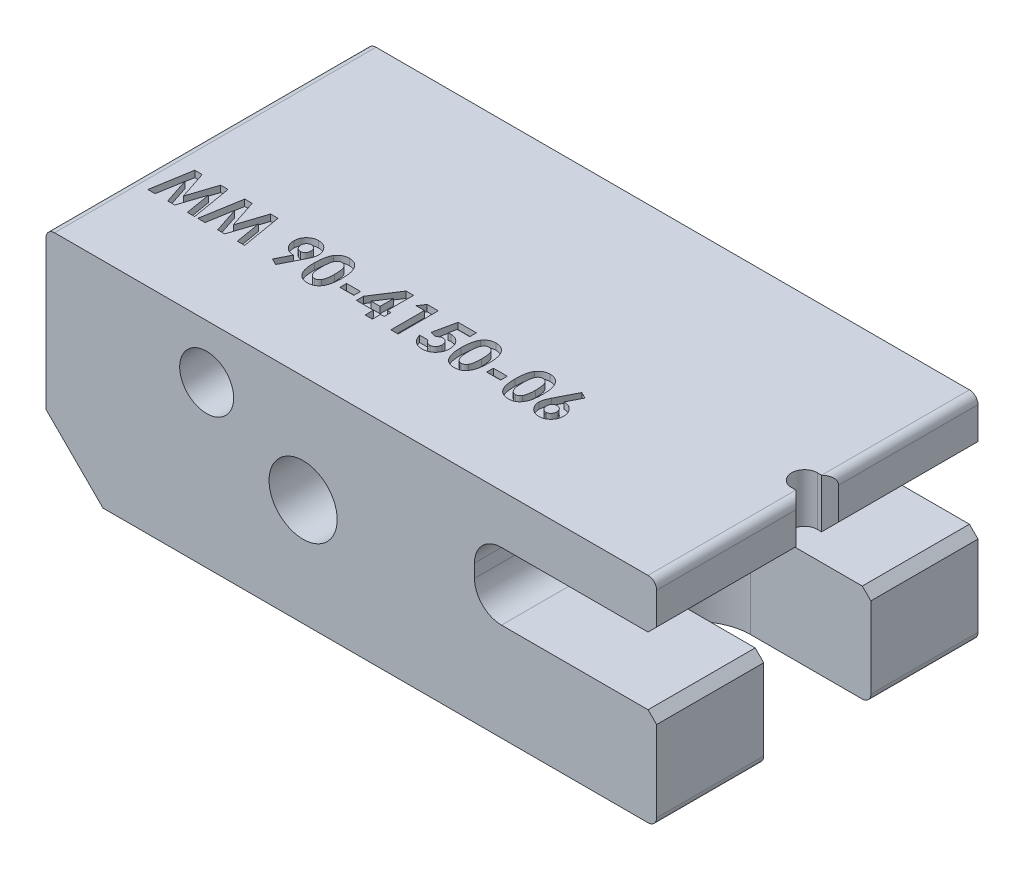
from build123d import *

# Parameters (mm, degrees)
CROQUIS1_W                          = 36.195
CROQUIS1_H                          = 19.05
SALIENTE_EXTRUIR1_DEPTH             = 12.7
TALADRO_ROSCADO_10_321_D            = 4.0386
TALADROS_DE_ESPIGA_DE_1_8_0_126_1_D = 3.2004
CORTAR_EXTRUIR1_DEPTH               = 43.828384571
CORTAR_EXTRUIR2_DEPTH               = 43.828384571
REDONDEO1_R                         = 0.508
CHAFL_N1_SIZE                       = 0.508
CORTAR_EXTRUIR3_DEPTH               = 43.828384571
CORTAR_EXTRUIR4_REACH               = 44.828
CORTAR_EXTRUIR5_DEPTH               = 43.828384646
CROQUIS12_W                         = 0.824278847
CROQUIS12_H                         = 0.396875
CROQUIS12_W_2                       = 0.824278846
CORTAR_EXTRUIR6_DEPTH               = 0.381


with BuildPart() as part:
    # Croquis1 → Saliente-Extruir1 (new body)
    with BuildSketch(Plane(origin=(0, 0, 0), x_dir=(1, 0, 0), z_dir=(0, 1, 0))):
        with Locations((18.0975, -9.525)):
            Rectangle(CROQUIS1_W, CROQUIS1_H)
    extrude(amount=SALIENTE_EXTRUIR1_DEPTH)

    # Taladro roscado #10-321 (through all)
    with Locations(Plane.XY.offset(19.05)):
        with Locations((15.24, 6.35)):
            Hole(TALADRO_ROSCADO_10_321_D / 2)

    # Taladros de espiga de 1/8 (0.126)1 (through all)
    with Locations(Plane.XY.offset(19.05)):
        with Locations((9.525, 9.525)):
            Hole(TALADROS_DE_ESPIGA_DE_1_8_0_126_1_D / 2)

    # Croquis6 → Cortar-Extruir1 (cut, through all)
    with BuildSketch(Plane.XY.offset(19.05)):
        with BuildLine():
            Line((36.195, 5.8039), (27.0002, 5.8039))
            ThreePointArc((27.0002, 5.8039), (25.868687729, 6.272587729), (25.4, 7.4041))
            Line((25.4, 7.4041), (25.4, 8.1915))
            ThreePointArc((25.4, 8.1915), (25.868687729, 9.323012271), (27.0002, 9.7917))
            Line((27.0002, 9.7917), (36.195, 9.7917))
            ThreePointArc((36.195, 9.7917), (38.1889, 7.7978), (36.195, 5.8039))
        make_face()
    extrude(amount=-CORTAR_EXTRUIR1_DEPTH, mode=Mode.SUBTRACT)

    # Croquis7 → Cortar-Extruir2 (cut, through all)
    with BuildSketch(Plane.XY.offset(19.05)):
        Polygon((0, 3.3782), (3.3782, 0), (0, 0), align=None)
    extrude(amount=-CORTAR_EXTRUIR2_DEPTH, mode=Mode.SUBTRACT)

    # Redondeo1
    redondeo1_edges = [part.edges().sort_by_distance(p)[0] for p in [
        (36.195, 12.7, 9.525),
        (0, 12.7, 9.525),
        (36.195, 0, 9.525),
    ]]
    fillet(redondeo1_edges, radius=REDONDEO1_R)

    # Chaflán1
    chafl_n1_edges = [part.edges().sort_by_distance(p)[0] for p in [
        (36.195, 9.7917, 9.525),
        (36.195, 5.8039, 9.525),
    ]]
    chamfer(chafl_n1_edges, length=CHAFL_N1_SIZE)

    # Croquis8 → Cortar-Extruir3 (cut, through all)
    with BuildSketch(Plane(origin=(0, 12.7, 0), x_dir=(1, 0, 0), z_dir=(0, 1, 0))):
        with BuildLine():
            Line((36.195, -10.287), (35.433, -10.287))
            ThreePointArc((35.433, -10.287), (34.671, -9.525), (35.433, -8.763))
            Line((35.433, -8.763), (36.195, -8.763))
            ThreePointArc((36.195, -8.763), (36.957, -9.525), (36.195, -10.287))
        make_face()
    extrude(amount=-CORTAR_EXTRUIR3_DEPTH, mode=Mode.SUBTRACT)

    # Croquis9 → Cortar-Extruir4 (cut, up to next)
    with BuildSketch(Plane(origin=(0, 0, 0), x_dir=(1, 0, 0), z_dir=(0, 1, 0)), mode=Mode.PRIVATE) as cortar_extruir4_sk1:
        with BuildLine():
            Line((36.195, -12.7), (29.0576, -12.7))
            ThreePointArc((29.0576, -12.7), (25.8826, -9.525), (29.0576, -6.35))
            Line((29.0576, -6.35), (36.195, -6.35))
            ThreePointArc((36.195, -6.35), (39.37, -9.525), (36.195, -12.7))
        make_face()
    cortar_extruir4_tool1 = extrude(cortar_extruir4_sk1.sketch, amount=CORTAR_EXTRUIR4_REACH, mode=Mode.PRIVATE) & part.part
    add(cortar_extruir4_tool1.solids().sort_by_distance((32.6263, 0, 9.525))[0], mode=Mode.SUBTRACT)

    # Croquis11 → Cortar-Extruir5 (cut, through all)
    with BuildSketch(Plane(origin=(0, 12.7, 0), x_dir=(1, 0, 0), z_dir=(0, 1, 0))):
        Polygon((35.687, -8.763), (36.195, -8.255), (36.195, -8.763), align=None)
        Polygon((35.687, -10.287), (36.195, -10.795), (36.195, -10.287), align=None)
    extrude(amount=-CORTAR_EXTRUIR5_DEPTH, mode=Mode.SUBTRACT)

    # Croquis12 → Cortar-Extruir6 (cut)
    # profile 1 of 12: a face of its own
    with BuildSketch(Plane(origin=(0, 12.7, 0), x_dir=(1, 0, 0), z_dir=(0, 1, 0))):
        Polygon((1.45230255, -11.68486249), (1.895924846, -11.68486249), (2.439242904, -13.345822526), (2.986377069, -11.68486249), (3.425706246, -11.68486249), (3.828305404, -14.06611249), (3.395654413, -14.06611249), (3.141406366, -12.562089804), (2.646266642, -14.06611249), (2.229357087, -14.06611249), (1.737079443, -12.562089804), (1.483308409, -14.06611249), (1.050180404, -14.06611249), align=None)
    # profile 2 of 12: a face of its own
    with BuildSketch(Plane(origin=(0, 12.7, 0), x_dir=(1, 0, 0), z_dir=(0, 1, 0))):
        Polygon((4.413600627, -11.68486249), (4.857222922, -11.68486249), (5.400540981, -13.345822526), (5.947675146, -11.68486249), (6.387004323, -11.68486249), (6.789603481, -14.06611249), (6.35695249, -14.06611249), (6.102704443, -12.562089804), (5.607564719, -14.06611249), (5.190655164, -14.06611249), (4.69837752, -12.562089804), (4.444606486, -14.06611249), (4.011478481, -14.06611249), align=None)
    # profile 3 of 12: a face of its own
    with BuildSketch(Plane(origin=(0, 12.7, 0), x_dir=(1, 0, 0), z_dir=(0, 1, 0))):
        with BuildLine():
            Line((8.691932207, -14.127170182), (8.31318371, -13.936364894))
            Line((8.31318371, -13.936364894), (8.728185212, -13.119718259))
            add(Edge.make_bspline(
                [(8.728185212, -13.119718259), (8.703665971, -13.119093296), (8.655528767, -13.117866343), (8.584650491, -13.107670372), (8.516871302, -13.090265199), (8.451392306, -13.067094529), (8.389119058, -13.036031844), (8.329296445, -12.99896016), (8.272752613, -12.954419065), (8.219222453, -12.904353033), (8.170347706, -12.849013861), (8.12792546, -12.789497518), (8.090949592, -12.727313759), (8.06219513, -12.661058742), (8.039099399, -12.591967294), (8.022224493, -12.519681792), (8.012754743, -12.443885092), (8.01143114, -12.392298687), (8.010757327, -12.36603737)],
                knots=[0, 0, 0, 0, 1.014336294, 1.991387562, 2.955278539, 3.906441712, 4.859855302, 5.829322156, 6.813833455, 7.833278715, 8.858926674, 9.863225732, 10.85404919, 11.846815163, 12.845559416, 13.865450493, 14.913355531, 16, 16, 16, 16], degree=3))
            add(Edge.make_bspline(
                [(8.010757327, -12.36603737), (8.011382325, -12.340564151), (8.01261387, -12.2903697), (8.022841971, -12.216700581), (8.039674778, -12.145967464), (8.062768787, -12.078182366), (8.093512789, -12.013802372), (8.12949786, -11.951819443), (8.173487978, -11.893515937), (8.223181845, -11.838639459), (8.277569146, -11.788437171), (8.335269506, -11.744297092), (8.396020571, -11.707400227), (8.45904163, -11.676413667), (8.525471834, -11.653262437), (8.594351191, -11.635795006), (8.666192809, -11.625713801), (8.7149574, -11.624446224), (8.739633529, -11.623804798)],
                knots=[0, 0, 0, 0, 1.055538678, 2.079917126, 3.075849687, 4.065898488, 5.041806164, 6.028602842, 7.031727914, 8.062953097, 9.093756959, 10.095582084, 11.068815425, 12.035667573, 13.000833448, 13.979119574, 14.977382875, 16, 16, 16, 16], degree=3))
            add(Edge.make_bspline(
                [(8.739633529, -11.623804798), (8.765435407, -11.624335901), (8.81617131, -11.625380245), (8.890441857, -11.636904166), (8.96150091, -11.654583968), (9.029637195, -11.678596746), (9.094004826, -11.711187057), (9.1551424, -11.750246771), (9.212846553, -11.79664011), (9.266497586, -11.849029875), (9.315292601, -11.906013546), (9.35854331, -11.965661703), (9.394875742, -12.027857717), (9.424634227, -12.092046509), (9.447815936, -12.158328639), (9.463750407, -12.226798126), (9.474329128, -12.297337883), (9.475532776, -12.345169052), (9.476141943, -12.369376462)],
                knots=[0, 0, 0, 0, 1.062826075, 2.08990367, 3.089830715, 4.078784409, 5.060762809, 6.057138927, 7.064407536, 8.107320944, 9.143871033, 10.153461498, 11.140480137, 12.108246174, 13.065926856, 14.029354859, 15.002654194, 16, 16, 16, 16], degree=3))
            add(Edge.make_bspline(
                [(9.476141943, -12.369376462), (9.475809515, -12.387838879), (9.475139929, -12.425026338), (9.468556058, -12.480792964), (9.458566999, -12.536714152), (9.446972581, -12.583730002), (9.434817447, -12.623361508), (9.422989117, -12.65698149), (9.407813022, -12.694305984), (9.390867394, -12.735585165), (9.371242364, -12.78063802), (9.34853104, -12.829249179), (9.324106035, -12.882139594), (9.306102395, -12.918305339), (9.296784972, -12.937022196)],
                knots=[0, 0, 0, 0, 1.105131805, 2.225983929, 3.357782449, 4.505488967, 5.122909461, 5.839607681, 6.638776516, 7.535249922, 8.51168636, 9.581005249, 10.748097757, 12, 12, 12, 12], degree=3))
            Line((9.296784972, -12.937022196), (8.691932207, -14.127170182))
        make_face()
        with BuildLine():
            add(Edge.make_bspline(
                [(8.749173794, -12.722843259), (8.769653205, -12.721637577), (8.809665339, -12.719281947), (8.867140107, -12.701067712), (8.918577103, -12.669898209), (8.96416758, -12.62848911), (9.001842154, -12.577968114), (9.029234035, -12.520454452), (9.046106591, -12.457139167), (9.047844079, -12.413050637), (9.048738097, -12.390365044)],
                knots=[0, 0, 0, 0, 0.984774978, 1.924027336, 2.867853169, 3.859505234, 4.871392407, 5.881338128, 6.909850265, 8, 8, 8, 8], degree=3))
            add(Edge.make_bspline(
                [(9.048738097, -12.390365044), (9.047661349, -12.367207539), (9.045566819, -12.322160662), (9.028532631, -12.257325568), (8.99942463, -12.198718488), (8.959824861, -12.147772796), (8.913592646, -12.10513776), (8.86189336, -12.073994014), (8.80598237, -12.05473572), (8.767290008, -12.052392454), (8.747742754, -12.051208644)],
                knots=[0, 0, 0, 0, 1.104110315, 2.147758178, 3.172670271, 4.206310416, 5.210906102, 6.157051016, 7.068948237, 8, 8, 8, 8], degree=3))
            add(Edge.make_bspline(
                [(8.747742754, -12.051208644), (8.727082404, -12.052362706), (8.686515976, -12.054628698), (8.628327346, -12.073840745), (8.574686565, -12.104386427), (8.527843289, -12.147166121), (8.48730223, -12.197440875), (8.459031843, -12.25624578), (8.441147015, -12.32062843), (8.43917435, -12.36575609), (8.438161174, -12.388934004)],
                knots=[0, 0, 0, 0, 0.970967322, 1.90648639, 2.855811969, 3.858352357, 4.877096915, 5.878517833, 6.91039038, 8, 8, 8, 8], degree=3))
            add(Edge.make_bspline(
                [(8.438161174, -12.388934004), (8.439219499, -12.411781535), (8.441277831, -12.456217596), (8.458528748, -12.519891967), (8.486628764, -12.577709996), (8.52504349, -12.628629421), (8.572360973, -12.670242548), (8.626086331, -12.701080032), (8.686015726, -12.719331335), (8.727742132, -12.721651545), (8.749173794, -12.722843259)],
                knots=[0, 0, 0, 0, 1.075706617, 2.092137047, 3.084482865, 4.090466434, 5.0784141, 6.035155512, 6.990809768, 8, 8, 8, 8], degree=3))
        make_face(mode=Mode.SUBTRACT)
    # profile 4 of 12: a face of its own
    with BuildSketch(Plane(origin=(0, 12.7, 0), x_dir=(1, 0, 0), z_dir=(0, 1, 0))):
        with BuildLine():
            add(Edge.make_bspline(
                [(10.552760783, -11.623804798), (10.573448903, -11.624111919), (10.614127275, -11.624715801), (10.674038859, -11.631256333), (10.731750279, -11.641137254), (10.787487309, -11.654917693), (10.840848749, -11.673155614), (10.892222973, -11.694986092), (10.940998481, -11.721554181), (10.987797315, -11.751564202), (11.032601449, -11.785539801), (11.074334046, -11.824273737), (11.113757233, -11.866874742), (11.150017642, -11.913986866), (11.183918272, -11.965181575), (11.21534773, -12.020466987), (11.244065417, -12.080113686), (11.27039319, -12.144229309), (11.293935567, -12.213774923), (11.313765282, -12.289548245), (11.33077258, -12.371566581), (11.34512794, -12.460034085), (11.355978273, -12.555068352), (11.363291615, -12.656606246), (11.368310376, -12.764452018), (11.368719973, -12.838433331), (11.368930404, -12.876441516)],
                knots=[0, 0, 0, 0, 0.879237366, 1.728815576, 2.559023295, 3.367336655, 4.166867292, 4.954216142, 5.737608147, 6.525189134, 7.316157332, 8.124696809, 8.942788509, 9.781158001, 10.649253743, 11.551476218, 12.482711956, 13.461909668, 14.496590415, 15.601789533, 16.789733467, 18.056700938, 19.410929216, 20.8549011, 22.384193279, 24, 24, 24, 24], degree=3))
            add(Edge.make_bspline(
                [(11.368930404, -12.876441516), (11.368702985, -12.914925227), (11.368261112, -12.989698387), (11.363500246, -13.098530571), (11.35530181, -13.200805691), (11.344735074, -13.296513167), (11.330261537, -13.385602458), (11.313311012, -13.468304244), (11.293168291, -13.544588547), (11.268850435, -13.614283485), (11.242682026, -13.678511709), (11.213885784, -13.738042111), (11.182963623, -13.793035932), (11.150624806, -13.844322828), (11.115096398, -13.890390887), (11.078107669, -13.932806665), (11.038048062, -13.96995449), (10.996604241, -14.003748794), (10.952257953, -14.032953855), (10.905466528, -14.058496119), (10.855395757, -14.079213929), (10.802958344, -14.097233174), (10.747260485, -14.110169048), (10.689187208, -14.120433238), (10.628082881, -14.126105859), (10.586480593, -14.126809585), (10.565163127, -14.127170182)],
                knots=[0, 0, 0, 0, 1.643780988, 3.193836972, 4.651895693, 6.025988579, 7.305620092, 8.505800249, 9.631074763, 10.672816429, 11.65661981, 12.592235626, 13.49536222, 14.350718032, 15.179365177, 15.97804903, 16.751647189, 17.51006938, 18.259804725, 19.016521909, 19.783502495, 20.571750527, 21.382245291, 22.22305063, 23.089471752, 24, 24, 24, 24], degree=3))
            add(Edge.make_bspline(
                [(10.565163127, -14.127170182), (10.543846236, -14.12680263), (10.50208676, -14.1260826), (10.4408172, -14.120475417), (10.382436165, -14.110127467), (10.326297646, -14.097133862), (10.272792357, -14.079253799), (10.221663744, -14.057916127), (10.17330494, -14.032533233), (10.127582048, -14.003260127), (10.084651178, -13.969691933), (10.043845186, -13.932187698), (10.005254336, -13.890842488), (9.969465691, -13.845193202), (9.935893137, -13.795849161), (9.904886782, -13.742246882), (9.87646526, -13.684464408), (9.84973954, -13.622421196), (9.826518273, -13.554781527), (9.805852424, -13.480941387), (9.788923504, -13.400285258), (9.775308133, -13.312839052), (9.764437629, -13.218788027), (9.756351224, -13.118086787), (9.751563913, -13.010688428), (9.751126675, -12.936868186), (9.750901558, -12.898861138)],
                knots=[0, 0, 0, 0, 0.917216111, 1.796812873, 2.643793957, 3.46689424, 4.273913431, 5.068098542, 5.848489301, 6.620921603, 7.401012384, 8.190319798, 9.003608147, 9.831726257, 10.68377682, 11.569763213, 12.493818149, 13.453288342, 14.474581811, 15.568529029, 16.750744269, 18.018426408, 19.375425659, 20.823733699, 22.36466933, 24, 24, 24, 24], degree=3))
            add(Edge.make_bspline(
                [(9.750901558, -12.898861138), (9.751309336, -12.846053337), (9.752096147, -12.744160004), (9.762067203, -12.596953765), (9.776702185, -12.460887096), (9.798197505, -12.336187604), (9.824776172, -12.222393438), (9.858811539, -12.120254216), (9.897558328, -12.028356611), (9.93057557, -11.973915916), (9.946476979, -11.947696775)],
                knots=[0, 0, 0, 0, 1.288568992, 2.486310467, 3.599230591, 4.627010532, 5.572937695, 6.447898582, 7.252493626, 8, 8, 8, 8], degree=3))
            add(Edge.make_bspline(
                [(9.946476979, -11.947696775), (9.96496638, -11.921939099), (10.001116801, -11.871577767), (10.064326824, -11.805462751), (10.132237763, -11.748917952), (10.206244471, -11.70322303), (10.285176502, -11.66718801), (10.369711525, -11.641736881), (10.459537369, -11.626907868), (10.521222274, -11.624854601), (10.552760783, -11.623804798)],
                knots=[0, 0, 0, 0, 1.058512271, 2.069600068, 3.047294572, 4.004278952, 4.967380941, 5.939006123, 6.946246673, 8, 8, 8, 8], degree=3))
        make_face()
        with BuildLine():
            add(Edge.make_bspline(
                [(10.563255074, -12.051208644), (10.544552842, -12.052095092), (10.507886539, -12.053833002), (10.454681987, -12.068585405), (10.404513416, -12.091371286), (10.366351524, -12.118790532), (10.337787728, -12.145075167), (10.317829998, -12.168861907), (10.298583914, -12.195406194), (10.281584803, -12.225905837), (10.265533204, -12.259264945), (10.249845955, -12.295634951), (10.236986529, -12.33590918), (10.224352484, -12.379401756), (10.213283882, -12.427315134), (10.20401082, -12.480040952), (10.195726155, -12.537922093), (10.189947502, -12.600996467), (10.184560063, -12.669198084), (10.180698091, -12.74267887), (10.179083498, -12.821419002), (10.178570268, -12.875646162), (10.178305404, -12.90363127)],
                knots=[0, 0, 0, 0, 1.076674018, 2.110852608, 3.161083442, 4.239746716, 4.804137807, 5.395870207, 6.026861976, 6.692161227, 7.405688833, 8.16177676, 8.973626916, 9.841385931, 10.773283133, 11.807421078, 12.927755683, 14.143907515, 15.458935494, 16.872852025, 18.386167141, 20, 20, 20, 20], degree=3))
            add(Edge.make_bspline(
                [(10.178305404, -12.90363127), (10.178741338, -12.93988733), (10.179577272, -13.009411013), (10.183955506, -13.10938849), (10.192731312, -13.200376045), (10.203646643, -13.282990334), (10.218977671, -13.35669558), (10.236617011, -13.422189105), (10.258400027, -13.478636024), (10.2835745, -13.526852687), (10.311456363, -13.567870502), (10.341723352, -13.60273583), (10.373344984, -13.632927559), (10.407308274, -13.657451928), (10.443532194, -13.676246274), (10.481714343, -13.689764815), (10.521878983, -13.698040077), (10.549383315, -13.69918759), (10.563255074, -13.699766336)],
                knots=[0, 0, 0, 0, 1.771748488, 3.397459088, 4.888034009, 6.237357457, 7.467047327, 8.564189669, 9.548206622, 10.417051504, 11.216568818, 11.965764335, 12.669334354, 13.348544111, 14.005342236, 14.656555988, 15.322436492, 16, 16, 16, 16], degree=3))
            add(Edge.make_bspline(
                [(10.563255074, -13.699766336), (10.576650798, -13.699370315), (10.60287796, -13.698594955), (10.641123037, -13.690635991), (10.677290298, -13.677696443), (10.711270545, -13.659392544), (10.74318532, -13.636116336), (10.772878643, -13.607765533), (10.800126572, -13.574057545), (10.81600134, -13.549041232), (10.824181306, -13.536150801)],
                knots=[0, 0, 0, 0, 0.992283464, 1.942767638, 2.88273346, 3.832339453, 4.79467288, 5.803907806, 6.868395428, 8, 8, 8, 8], degree=3))
            add(Edge.make_bspline(
                [(10.824181306, -13.536150801), (10.833811838, -13.51853644), (10.854006283, -13.481600552), (10.87737533, -13.41927262), (10.897046092, -13.348977013), (10.913976428, -13.270494965), (10.925555746, -13.183516934), (10.93552784, -13.088594455), (10.940337628, -12.985249536), (10.941119967, -12.913651804), (10.941526558, -12.876441516)],
                knots=[0, 0, 0, 0, 0.710965849, 1.490837728, 2.352621235, 3.297892224, 4.334225155, 5.461620853, 6.680770821, 8, 8, 8, 8], degree=3))
            add(Edge.make_bspline(
                [(10.941526558, -12.876441516), (10.941369501, -12.838908226), (10.941067192, -12.766663048), (10.935520698, -12.662946597), (10.927796781, -12.568218833), (10.916498921, -12.482691243), (10.901962171, -12.406156204), (10.884045571, -12.33861872), (10.862923233, -12.279945687), (10.837874656, -12.230195611), (10.810131802, -12.18791487), (10.780681915, -12.151641274), (10.74940047, -12.120671793), (10.716339779, -12.094889884), (10.68073464, -12.075190571), (10.64326516, -12.061281227), (10.603854521, -12.05286654), (10.576970886, -12.051768735), (10.563255074, -12.051208644)],
                knots=[0, 0, 0, 0, 1.793836731, 3.452829483, 4.963243077, 6.335886805, 7.574563692, 8.684454726, 9.672768357, 10.54971625, 11.340229787, 12.085688095, 12.778991901, 13.440269426, 14.083255152, 14.715733572, 15.344777694, 16, 16, 16, 16], degree=3))
        make_face(mode=Mode.SUBTRACT)
    # profile 5 of 12: a face of its own
    with BuildSketch(Plane(origin=(0, 12.7, 0), x_dir=(1, 0, 0), z_dir=(0, 1, 0))):
        with Locations((12.177944827, -13.196040375)):
            Rectangle(CROQUIS12_W, CROQUIS12_H)
    # profile 6 of 12: a face of its own
    with BuildSketch(Plane(origin=(0, 12.7, 0), x_dir=(1, 0, 0), z_dir=(0, 1, 0))):
        Polygon((13.915226979, -11.623804798), (14.360757327, -11.623804798), (14.360757327, -13.180775952), (14.574459251, -13.180775952), (14.574459251, -13.577650952), (14.360757327, -13.577650952), (14.360757327, -14.06611249), (13.933353481, -14.06611249), (13.933353481, -13.577650952), (12.925901558, -13.577650952), (12.925901558, -13.14499996), align=None)
        Polygon((13.933353481, -13.180775952), (13.933353481, -12.370330489), (13.406253872, -13.180775952), align=None, mode=Mode.SUBTRACT)
    # profile 7 of 12: a face of its own
    with BuildSketch(Plane(origin=(0, 12.7, 0), x_dir=(1, 0, 0), z_dir=(0, 1, 0))):
        Polygon((15.226536324, -11.68486249), (15.887199635, -11.68486249), (15.887199635, -14.06611249), (15.459795789, -14.06611249), (15.459795789, -12.08173749), (14.971334251, -12.08173749), align=None)
    # profile 8 of 12: a face of its own
    with BuildSketch(Plane(origin=(0, 12.7, 0), x_dir=(1, 0, 0), z_dir=(0, 1, 0))):
        with BuildLine():
            Line((17.062083199, -11.68486249), (18.146334251, -11.68486249))
            Line((18.146334251, -11.68486249), (18.146334251, -12.08173749))
            Line((18.146334251, -12.08173749), (17.400762586, -12.08173749))
            Line((17.400762586, -12.08173749), (17.307745008, -12.532037971))
            add(Edge.make_bspline(
                [(17.307745008, -12.532037971), (17.320419984, -12.52850783), (17.345417642, -12.521545666), (17.383076645, -12.514563498), (17.419573467, -12.510037878), (17.443522458, -12.50943422), (17.455142093, -12.509141336)],
                knots=[0, 0, 0, 0, 1.05461699, 2.079921384, 3.068411212, 4, 4, 4, 4], degree=3))
            add(Edge.make_bspline(
                [(17.455142093, -12.509141336), (17.480462494, -12.509721538), (17.530374583, -12.510865245), (17.603389635, -12.521722751), (17.673305861, -12.538822994), (17.739909309, -12.563211469), (17.803134917, -12.594953699), (17.863059326, -12.633352899), (17.919756084, -12.678476512), (17.972218017, -12.730352789), (18.020422233, -12.787314117), (18.062333049, -12.848923819), (18.098127502, -12.914303403), (18.126597172, -12.983859265), (18.149067862, -13.057154549), (18.165305685, -13.134236224), (18.174907921, -13.215195644), (18.176202724, -13.270428468), (18.176863097, -13.298598217)],
                knots=[0, 0, 0, 0, 1.01440847, 1.999622559, 2.951875003, 3.895578053, 4.836219714, 5.782137149, 6.743708247, 7.735272588, 8.734977101, 9.730283169, 10.717124674, 11.717316708, 12.737475749, 13.78628267, 14.87096371, 16, 16, 16, 16], degree=3))
            add(Edge.make_bspline(
                [(18.176863097, -13.298598217), (18.17605611, -13.327087758), (18.17446369, -13.383305951), (18.164074608, -13.46596658), (18.145737692, -13.545136802), (18.120550102, -13.621028554), (18.087367066, -13.693084048), (18.047459923, -13.762049727), (18.000153951, -13.82741368), (17.945913384, -13.888505848), (17.886946774, -13.944345262), (17.824161252, -13.993467301), (17.757997908, -14.034803099), (17.688455145, -14.068209413), (17.615931951, -14.094639893), (17.540406315, -14.113880021), (17.461511192, -14.124913166), (17.407951654, -14.126409576), (17.380728031, -14.127170182)],
                knots=[0, 0, 0, 0, 1.06808661, 2.107647099, 3.116961351, 4.110378221, 5.100014249, 6.085620622, 7.093190682, 8.119403071, 9.144090782, 10.133780668, 11.103064255, 12.062861538, 13.020824475, 13.992378307, 14.979551724, 16, 16, 16, 16], degree=3))
            add(Edge.make_bspline(
                [(17.380728031, -14.127170182), (17.356382754, -14.126547959), (17.308368774, -14.125320805), (17.237646289, -14.117778068), (17.169461961, -14.104442438), (17.104177772, -14.085142329), (17.041106825, -14.061388301), (16.980978237, -14.0316794), (16.923461592, -13.996581323), (16.868720215, -13.956734612), (16.817643576, -13.911848836), (16.771026231, -13.862713622), (16.728585955, -13.809948293), (16.691230902, -13.752901887), (16.659078169, -13.691658685), (16.630564469, -13.626940455), (16.60722572, -13.558071329), (16.595381978, -13.510327425), (16.589363097, -13.486064413)],
                knots=[0, 0, 0, 0, 1.054957082, 2.080596141, 3.077793124, 4.061112343, 5.027190972, 5.994718051, 6.962465889, 7.943658696, 8.924948258, 9.904494768, 10.875059, 11.855380583, 12.854004648, 13.869083016, 14.917087635, 16, 16, 16, 16], degree=3))
            Line((16.589363097, -13.486064413), (17.077824635, -13.486064413))
            add(Edge.make_bspline(
                [(17.077824635, -13.486064413), (17.086753724, -13.502877692), (17.104106389, -13.535552382), (17.137114994, -13.578932941), (17.174066031, -13.615926019), (17.214626183, -13.646893045), (17.259058254, -13.670093014), (17.305551721, -13.687686797), (17.354690661, -13.697853593), (17.388156449, -13.699124543), (17.405055705, -13.699766336)],
                knots=[0, 0, 0, 0, 1.104910296, 2.147267069, 3.153527244, 4.136738762, 5.099945312, 6.05603338, 7.018353, 8, 8, 8, 8], degree=3))
            add(Edge.make_bspline(
                [(17.405055705, -13.699766336), (17.41683426, -13.699323172), (17.440008765, -13.69845124), (17.474152734, -13.6938385), (17.506744653, -13.685102075), (17.538026834, -13.673004156), (17.568083309, -13.657916686), (17.596483209, -13.638869738), (17.623720641, -13.616945994), (17.64938094, -13.591788424), (17.672621775, -13.563743585), (17.693001445, -13.533607494), (17.71122368, -13.502049781), (17.724721168, -13.467820365), (17.73577447, -13.43194135), (17.743914568, -13.39414209), (17.748779195, -13.354378436), (17.749229529, -13.327232905), (17.749459251, -13.313385627)],
                knots=[0, 0, 0, 0, 0.978869489, 1.925942215, 2.855067702, 3.774946051, 4.70828698, 5.642468714, 6.60995405, 7.609372294, 8.622401667, 9.629904756, 10.629323, 11.642352373, 12.678539694, 13.745912462, 14.850161547, 16, 16, 16, 16], degree=3))
            add(Edge.make_bspline(
                [(17.749459251, -13.313385627), (17.749192633, -13.299859776), (17.748673654, -13.273531379), (17.74438056, -13.234871861), (17.736700299, -13.198190975), (17.726235876, -13.163207773), (17.712840166, -13.13013469), (17.696469713, -13.098774858), (17.677054581, -13.06928679), (17.654490533, -13.042270834), (17.630428465, -13.017491031), (17.604578072, -12.995818813), (17.577172252, -12.977832377), (17.549062608, -12.962129695), (17.519127104, -12.950701625), (17.488038869, -12.942831535), (17.455830596, -12.937056779), (17.433862032, -12.936717491), (17.422705194, -12.936545182)],
                knots=[0, 0, 0, 0, 1.166249705, 2.270133367, 3.348514167, 4.393962215, 5.415026464, 6.420877785, 7.440098956, 8.453121383, 9.451844239, 10.415694839, 11.355045125, 12.27538808, 13.187007209, 14.108269027, 15.039275622, 16, 16, 16, 16], degree=3))
            add(Edge.make_bspline(
                [(17.422705194, -12.936545182), (17.410586276, -12.937005028), (17.386297363, -12.937926657), (17.350210118, -12.945425709), (17.314557985, -12.957561987), (17.279142701, -12.974305906), (17.244315824, -12.996218413), (17.209158257, -13.021919272), (17.174846798, -13.053275893), (17.153030617, -13.076630376), (17.141744407, -13.0887124)],
                knots=[0, 0, 0, 0, 0.88288272, 1.769486374, 2.674910571, 3.623812639, 4.617874466, 5.670434592, 6.794841017, 8, 8, 8, 8], degree=3))
            Line((17.141744407, -13.0887124), (16.782076438, -13.006189113))
            Line((16.782076438, -13.006189113), (17.062083199, -11.68486249))
        make_face()
    # profile 9 of 12: a face of its own
    with BuildSketch(Plane(origin=(0, 12.7, 0), x_dir=(1, 0, 0), z_dir=(0, 1, 0))):
        with BuildLine():
            add(Edge.make_bspline(
                [(19.253481937, -11.623804798), (19.274170057, -11.624111919), (19.314848429, -11.624715801), (19.374760013, -11.631256333), (19.432471433, -11.641137254), (19.488208463, -11.654917693), (19.541569903, -11.673155614), (19.592944127, -11.694986092), (19.641719635, -11.721554181), (19.688518469, -11.751564202), (19.733322602, -11.785539801), (19.7750552, -11.824273737), (19.814478386, -11.866874742), (19.850738796, -11.913986866), (19.884639426, -11.965181575), (19.916068884, -12.020466987), (19.944786571, -12.080113686), (19.971114343, -12.144229309), (19.99465672, -12.213774923), (20.014486435, -12.289548245), (20.031493734, -12.371566581), (20.045849094, -12.460034085), (20.056699426, -12.555068352), (20.064012769, -12.656606246), (20.06903153, -12.764452018), (20.069441127, -12.838433331), (20.069651558, -12.876441516)],
                knots=[0, 0, 0, 0, 0.879237366, 1.728815576, 2.559023295, 3.367336655, 4.166867292, 4.954216142, 5.737608147, 6.525189134, 7.316157332, 8.124696809, 8.942788509, 9.781158001, 10.649253743, 11.551476218, 12.482711956, 13.461909668, 14.496590415, 15.601789533, 16.789733467, 18.056700938, 19.410929216, 20.8549011, 22.384193279, 24, 24, 24, 24], degree=3))
            add(Edge.make_bspline(
                [(20.069651558, -12.876441516), (20.069424138, -12.914925227), (20.068982266, -12.989698387), (20.0642214, -13.098530571), (20.056022964, -13.200805691), (20.045456228, -13.296513167), (20.03098269, -13.385602458), (20.014032166, -13.468304244), (19.993889445, -13.544588547), (19.969571589, -13.614283485), (19.94340318, -13.678511709), (19.914606938, -13.738042111), (19.883684777, -13.793035932), (19.85134596, -13.844322828), (19.815817552, -13.890390887), (19.778828823, -13.932806665), (19.738769215, -13.96995449), (19.697325395, -14.003748794), (19.652979107, -14.032953855), (19.606187682, -14.058496119), (19.556116911, -14.079213929), (19.503679498, -14.097233174), (19.447981638, -14.110169048), (19.389908362, -14.120433238), (19.328804034, -14.126105859), (19.287201747, -14.126809585), (19.265884281, -14.127170182)],
                knots=[0, 0, 0, 0, 1.643780988, 3.193836972, 4.651895693, 6.025988579, 7.305620092, 8.505800249, 9.631074763, 10.672816429, 11.65661981, 12.592235626, 13.49536222, 14.350718032, 15.179365177, 15.97804903, 16.751647189, 17.51006938, 18.259804725, 19.016521909, 19.783502495, 20.571750527, 21.382245291, 22.22305063, 23.089471752, 24, 24, 24, 24], degree=3))
            add(Edge.make_bspline(
                [(19.265884281, -14.127170182), (19.24456739, -14.12680263), (19.202807914, -14.1260826), (19.141538354, -14.120475417), (19.083157319, -14.110127467), (19.027018799, -14.097133862), (18.973513511, -14.079253799), (18.922384897, -14.057916127), (18.874026094, -14.032533233), (18.828303201, -14.003260127), (18.785372332, -13.969691933), (18.74456634, -13.932187698), (18.70597549, -13.890842488), (18.670186845, -13.845193202), (18.636614291, -13.795849161), (18.605607935, -13.742246882), (18.577186414, -13.684464408), (18.550460694, -13.622421196), (18.527239427, -13.554781527), (18.506573578, -13.480941387), (18.489644657, -13.400285258), (18.476029287, -13.312839052), (18.465158783, -13.218788027), (18.457072377, -13.118086787), (18.452285067, -13.010688428), (18.451847829, -12.936868186), (18.451622712, -12.898861138)],
                knots=[0, 0, 0, 0, 0.917216111, 1.796812873, 2.643793957, 3.46689424, 4.273913431, 5.068098542, 5.848489301, 6.620921603, 7.401012384, 8.190319798, 9.003608147, 9.831726257, 10.68377682, 11.569763213, 12.493818149, 13.453288342, 14.474581811, 15.568529029, 16.750744269, 18.018426408, 19.375425659, 20.823733699, 22.36466933, 24, 24, 24, 24], degree=3))
            add(Edge.make_bspline(
                [(18.451622712, -12.898861138), (18.452030489, -12.846053337), (18.452817301, -12.744160004), (18.462788357, -12.596953765), (18.477423338, -12.460887096), (18.498918659, -12.336187604), (18.525497326, -12.222393438), (18.559532693, -12.120254216), (18.598279482, -12.028356611), (18.631296724, -11.973915916), (18.647198133, -11.947696775)],
                knots=[0, 0, 0, 0, 1.288568992, 2.486310467, 3.599230591, 4.627010532, 5.572937695, 6.447898582, 7.252493626, 8, 8, 8, 8], degree=3))
            add(Edge.make_bspline(
                [(18.647198133, -11.947696775), (18.665687533, -11.921939099), (18.701837955, -11.871577767), (18.765047978, -11.805462751), (18.832958917, -11.748917952), (18.906965625, -11.70322303), (18.985897655, -11.66718801), (19.070432679, -11.641736881), (19.160258523, -11.626907868), (19.221943428, -11.624854601), (19.253481937, -11.623804798)],
                knots=[0, 0, 0, 0, 1.058512271, 2.069600068, 3.047294572, 4.004278952, 4.967380941, 5.939006123, 6.946246673, 8, 8, 8, 8], degree=3))
        make_face()
        with BuildLine():
            add(Edge.make_bspline(
                [(19.263976228, -12.051208644), (19.245273996, -12.052095092), (19.208607693, -12.053833002), (19.155403141, -12.068585405), (19.10523457, -12.091371286), (19.067072678, -12.118790532), (19.038508881, -12.145075167), (19.018551152, -12.168861907), (18.999305068, -12.195406194), (18.982305956, -12.225905837), (18.966254358, -12.259264945), (18.950567108, -12.295634951), (18.937707683, -12.33590918), (18.925073638, -12.379401756), (18.914005036, -12.427315134), (18.904731974, -12.480040952), (18.896447309, -12.537922093), (18.890668655, -12.600996467), (18.885281216, -12.669198084), (18.881419245, -12.74267887), (18.879804652, -12.821419002), (18.879291422, -12.875646162), (18.879026558, -12.90363127)],
                knots=[0, 0, 0, 0, 1.076674018, 2.110852608, 3.161083442, 4.239746716, 4.804137807, 5.395870207, 6.026861976, 6.692161227, 7.405688833, 8.16177676, 8.973626916, 9.841385931, 10.773283133, 11.807421078, 12.927755683, 14.143907515, 15.458935494, 16.872852025, 18.386167141, 20, 20, 20, 20], degree=3))
            add(Edge.make_bspline(
                [(18.879026558, -12.90363127), (18.879462492, -12.93988733), (18.880298426, -13.009411013), (18.88467666, -13.10938849), (18.893452466, -13.200376045), (18.904367797, -13.282990334), (18.919698825, -13.35669558), (18.937338165, -13.422189105), (18.959121181, -13.478636024), (18.984295654, -13.526852687), (19.012177517, -13.567870502), (19.042444506, -13.60273583), (19.074066138, -13.632927559), (19.108029428, -13.657451928), (19.144253348, -13.676246274), (19.182435497, -13.689764815), (19.222600137, -13.698040077), (19.250104469, -13.69918759), (19.263976228, -13.699766336)],
                knots=[0, 0, 0, 0, 1.771748488, 3.397459088, 4.888034009, 6.237357457, 7.467047327, 8.564189669, 9.548206622, 10.417051504, 11.216568818, 11.965764335, 12.669334354, 13.348544111, 14.005342236, 14.656555988, 15.322436492, 16, 16, 16, 16], degree=3))
            add(Edge.make_bspline(
                [(19.263976228, -13.699766336), (19.277371952, -13.699370315), (19.303599114, -13.698594955), (19.34184419, -13.690635991), (19.378011452, -13.677696443), (19.411991699, -13.659392544), (19.443906474, -13.636116336), (19.473599797, -13.607765533), (19.500847726, -13.574057545), (19.516722494, -13.549041232), (19.52490246, -13.536150801)],
                knots=[0, 0, 0, 0, 0.992283464, 1.942767638, 2.88273346, 3.832339453, 4.79467288, 5.803907806, 6.868395428, 8, 8, 8, 8], degree=3))
            add(Edge.make_bspline(
                [(19.52490246, -13.536150801), (19.534532992, -13.51853644), (19.554727437, -13.481600552), (19.578096484, -13.41927262), (19.597767245, -13.348977013), (19.614697582, -13.270494965), (19.626276899, -13.183516934), (19.636248993, -13.088594455), (19.641058782, -12.985249536), (19.641841121, -12.913651804), (19.642247712, -12.876441516)],
                knots=[0, 0, 0, 0, 0.710965849, 1.490837728, 2.352621235, 3.297892224, 4.334225155, 5.461620853, 6.680770821, 8, 8, 8, 8], degree=3))
            add(Edge.make_bspline(
                [(19.642247712, -12.876441516), (19.642090655, -12.838908226), (19.641788346, -12.766663048), (19.636241852, -12.662946597), (19.628517935, -12.568218833), (19.617220075, -12.482691243), (19.602683325, -12.406156204), (19.584766725, -12.33861872), (19.563644386, -12.279945687), (19.53859581, -12.230195611), (19.510852956, -12.18791487), (19.481403069, -12.151641274), (19.450121624, -12.120671793), (19.417060932, -12.094889884), (19.381455794, -12.075190571), (19.343986313, -12.061281227), (19.304575675, -12.05286654), (19.27769204, -12.051768735), (19.263976228, -12.051208644)],
                knots=[0, 0, 0, 0, 1.793836731, 3.452829483, 4.963243077, 6.335886805, 7.574563692, 8.684454726, 9.672768357, 10.54971625, 11.340229787, 12.085688095, 12.778991901, 13.440269426, 14.083255152, 14.715733572, 15.344777694, 16, 16, 16, 16], degree=3))
        make_face(mode=Mode.SUBTRACT)
    # profile 10 of 12: a face of its own
    with BuildSketch(Plane(origin=(0, 12.7, 0), x_dir=(1, 0, 0), z_dir=(0, 1, 0))):
        with Locations((20.878665981, -13.196040375)):
            Rectangle(CROQUIS12_W_2, CROQUIS12_H)
    # profile 11 of 12: a face of its own
    with BuildSketch(Plane(origin=(0, 12.7, 0), x_dir=(1, 0, 0), z_dir=(0, 1, 0))):
        with BuildLine():
            add(Edge.make_bspline(
                [(22.459010783, -11.623804798), (22.479698903, -11.624111919), (22.520377275, -11.624715801), (22.580288859, -11.631256333), (22.638000279, -11.641137254), (22.693737309, -11.654917693), (22.747098749, -11.673155614), (22.798472973, -11.694986092), (22.847248481, -11.721554181), (22.894047315, -11.751564202), (22.938851449, -11.785539801), (22.980584046, -11.824273737), (23.020007233, -11.866874742), (23.056267642, -11.913986866), (23.090168272, -11.965181575), (23.12159773, -12.020466987), (23.150315417, -12.080113686), (23.17664319, -12.144229309), (23.200185567, -12.213774923), (23.220015282, -12.289548245), (23.23702258, -12.371566581), (23.25137794, -12.460034085), (23.262228273, -12.555068352), (23.269541615, -12.656606246), (23.274560376, -12.764452018), (23.274969973, -12.838433331), (23.275180404, -12.876441516)],
                knots=[0, 0, 0, 0, 0.879237366, 1.728815576, 2.559023295, 3.367336655, 4.166867292, 4.954216142, 5.737608147, 6.525189134, 7.316157332, 8.124696809, 8.942788509, 9.781158001, 10.649253743, 11.551476218, 12.482711956, 13.461909668, 14.496590415, 15.601789533, 16.789733467, 18.056700938, 19.410929216, 20.8549011, 22.384193279, 24, 24, 24, 24], degree=3))
            add(Edge.make_bspline(
                [(23.275180404, -12.876441516), (23.274952985, -12.914925227), (23.274511112, -12.989698387), (23.269750246, -13.098530571), (23.26155181, -13.200805691), (23.250985074, -13.296513167), (23.236511537, -13.385602458), (23.219561012, -13.468304244), (23.199418291, -13.544588547), (23.175100435, -13.614283485), (23.148932026, -13.678511709), (23.120135784, -13.738042111), (23.089213623, -13.793035932), (23.056874806, -13.844322828), (23.021346398, -13.890390887), (22.984357669, -13.932806665), (22.944298062, -13.96995449), (22.902854241, -14.003748794), (22.858507953, -14.032953855), (22.811716528, -14.058496119), (22.761645757, -14.079213929), (22.709208344, -14.097233174), (22.653510485, -14.110169048), (22.595437208, -14.120433238), (22.534332881, -14.126105859), (22.492730593, -14.126809585), (22.471413127, -14.127170182)],
                knots=[0, 0, 0, 0, 1.643780988, 3.193836972, 4.651895693, 6.025988579, 7.305620092, 8.505800249, 9.631074763, 10.672816429, 11.65661981, 12.592235626, 13.49536222, 14.350718032, 15.179365177, 15.97804903, 16.751647189, 17.51006938, 18.259804725, 19.016521909, 19.783502495, 20.571750527, 21.382245291, 22.22305063, 23.089471752, 24, 24, 24, 24], degree=3))
            add(Edge.make_bspline(
                [(22.471413127, -14.127170182), (22.450096236, -14.12680263), (22.40833676, -14.1260826), (22.3470672, -14.120475417), (22.288686165, -14.110127467), (22.232547646, -14.097133862), (22.179042357, -14.079253799), (22.127913744, -14.057916127), (22.07955494, -14.032533233), (22.033832048, -14.003260127), (21.990901178, -13.969691933), (21.950095186, -13.932187698), (21.911504336, -13.890842488), (21.875715691, -13.845193202), (21.842143137, -13.795849161), (21.811136782, -13.742246882), (21.78271526, -13.684464408), (21.75598954, -13.622421196), (21.732768273, -13.554781527), (21.712102424, -13.480941387), (21.695173504, -13.400285258), (21.681558133, -13.312839052), (21.670687629, -13.218788027), (21.662601224, -13.118086787), (21.657813913, -13.010688428), (21.657376675, -12.936868186), (21.657151558, -12.898861138)],
                knots=[0, 0, 0, 0, 0.917216111, 1.796812873, 2.643793957, 3.46689424, 4.273913431, 5.068098542, 5.848489301, 6.620921603, 7.401012384, 8.190319798, 9.003608147, 9.831726257, 10.68377682, 11.569763213, 12.493818149, 13.453288342, 14.474581811, 15.568529029, 16.750744269, 18.018426408, 19.375425659, 20.823733699, 22.36466933, 24, 24, 24, 24], degree=3))
            add(Edge.make_bspline(
                [(21.657151558, -12.898861138), (21.657559336, -12.846053337), (21.658346147, -12.744160004), (21.668317203, -12.596953765), (21.682952185, -12.460887096), (21.704447505, -12.336187604), (21.731026172, -12.222393438), (21.765061539, -12.120254216), (21.803808328, -12.028356611), (21.83682557, -11.973915916), (21.852726979, -11.947696775)],
                knots=[0, 0, 0, 0, 1.288568992, 2.486310467, 3.599230591, 4.627010532, 5.572937695, 6.447898582, 7.252493626, 8, 8, 8, 8], degree=3))
            add(Edge.make_bspline(
                [(21.852726979, -11.947696775), (21.87121638, -11.921939099), (21.907366801, -11.871577767), (21.970576824, -11.805462751), (22.038487763, -11.748917952), (22.112494471, -11.70322303), (22.191426502, -11.66718801), (22.275961525, -11.641736881), (22.365787369, -11.626907868), (22.427472274, -11.624854601), (22.459010783, -11.623804798)],
                knots=[0, 0, 0, 0, 1.058512271, 2.069600068, 3.047294572, 4.004278952, 4.967380941, 5.939006123, 6.946246673, 8, 8, 8, 8], degree=3))
        make_face()
        with BuildLine():
            add(Edge.make_bspline(
                [(22.469505074, -12.051208644), (22.450802842, -12.052095092), (22.414136539, -12.053833002), (22.360931987, -12.068585405), (22.310763416, -12.091371286), (22.272601524, -12.118790532), (22.244037728, -12.145075167), (22.224079998, -12.168861907), (22.204833914, -12.195406194), (22.187834803, -12.225905837), (22.171783204, -12.259264945), (22.156095955, -12.295634951), (22.143236529, -12.33590918), (22.130602484, -12.379401756), (22.119533882, -12.427315134), (22.11026082, -12.480040952), (22.101976155, -12.537922093), (22.096197502, -12.600996467), (22.090810063, -12.669198084), (22.086948091, -12.74267887), (22.085333498, -12.821419002), (22.084820268, -12.875646162), (22.084555404, -12.90363127)],
                knots=[0, 0, 0, 0, 1.076674018, 2.110852608, 3.161083442, 4.239746716, 4.804137807, 5.395870207, 6.026861976, 6.692161227, 7.405688833, 8.16177676, 8.973626916, 9.841385931, 10.773283133, 11.807421078, 12.927755683, 14.143907515, 15.458935494, 16.872852025, 18.386167141, 20, 20, 20, 20], degree=3))
            add(Edge.make_bspline(
                [(22.084555404, -12.90363127), (22.084991338, -12.93988733), (22.085827272, -13.009411013), (22.090205506, -13.10938849), (22.098981312, -13.200376045), (22.109896643, -13.282990334), (22.125227671, -13.35669558), (22.142867011, -13.422189105), (22.164650027, -13.478636024), (22.1898245, -13.526852687), (22.217706363, -13.567870502), (22.247973352, -13.60273583), (22.279594984, -13.632927559), (22.313558274, -13.657451928), (22.349782194, -13.676246274), (22.387964343, -13.689764815), (22.428128983, -13.698040077), (22.455633315, -13.69918759), (22.469505074, -13.699766336)],
                knots=[0, 0, 0, 0, 1.771748488, 3.397459088, 4.888034009, 6.237357457, 7.467047327, 8.564189669, 9.548206622, 10.417051504, 11.216568818, 11.965764335, 12.669334354, 13.348544111, 14.005342236, 14.656555988, 15.322436492, 16, 16, 16, 16], degree=3))
            add(Edge.make_bspline(
                [(22.469505074, -13.699766336), (22.482900798, -13.699370315), (22.50912796, -13.698594955), (22.547373037, -13.690635991), (22.583540298, -13.677696443), (22.617520545, -13.659392544), (22.64943532, -13.636116336), (22.679128643, -13.607765533), (22.706376572, -13.574057545), (22.72225134, -13.549041232), (22.730431306, -13.536150801)],
                knots=[0, 0, 0, 0, 0.992283464, 1.942767638, 2.88273346, 3.832339453, 4.79467288, 5.803907806, 6.868395428, 8, 8, 8, 8], degree=3))
            add(Edge.make_bspline(
                [(22.730431306, -13.536150801), (22.740061838, -13.51853644), (22.760256283, -13.481600552), (22.78362533, -13.41927262), (22.803296092, -13.348977013), (22.820226428, -13.270494965), (22.831805746, -13.183516934), (22.84177784, -13.088594455), (22.846587628, -12.985249536), (22.847369967, -12.913651804), (22.847776558, -12.876441516)],
                knots=[0, 0, 0, 0, 0.710965849, 1.490837728, 2.352621235, 3.297892224, 4.334225155, 5.461620853, 6.680770821, 8, 8, 8, 8], degree=3))
            add(Edge.make_bspline(
                [(22.847776558, -12.876441516), (22.847619501, -12.838908226), (22.847317192, -12.766663048), (22.841770698, -12.662946597), (22.834046781, -12.568218833), (22.822748921, -12.482691243), (22.808212171, -12.406156204), (22.790295571, -12.33861872), (22.769173233, -12.279945687), (22.744124656, -12.230195611), (22.716381802, -12.18791487), (22.686931915, -12.151641274), (22.65565047, -12.120671793), (22.622589779, -12.094889884), (22.58698464, -12.075190571), (22.54951516, -12.061281227), (22.510104521, -12.05286654), (22.483220886, -12.051768735), (22.469505074, -12.051208644)],
                knots=[0, 0, 0, 0, 1.793836731, 3.452829483, 4.963243077, 6.335886805, 7.574563692, 8.684454726, 9.672768357, 10.54971625, 11.340229787, 12.085688095, 12.778991901, 13.440269426, 14.083255152, 14.715733572, 15.344777694, 16, 16, 16, 16], degree=3))
        make_face(mode=Mode.SUBTRACT)
    # profile 12 of 12: a face of its own
    with BuildSketch(Plane(origin=(0, 12.7, 0), x_dir=(1, 0, 0), z_dir=(0, 1, 0))):
        with BuildLine():
            Line((24.334149755, -11.623804798), (24.71242124, -11.815564113))
            Line((24.71242124, -11.815564113), (24.297419737, -12.631256721))
            add(Edge.make_bspline(
                [(24.297419737, -12.631256721), (24.321937637, -12.631891502), (24.37022966, -12.633141806), (24.441281574, -12.643246979), (24.509208526, -12.6607164), (24.574695421, -12.68387207), (24.636941744, -12.714970365), (24.696950006, -12.751963409), (24.753167763, -12.797080405), (24.806884041, -12.847067643), (24.855727976, -12.902446318), (24.898157569, -12.961952465), (24.93513421, -13.02413829), (24.963878363, -13.090395041), (24.987064354, -13.159624438), (25.003794066, -13.23210322), (25.013338836, -13.30804127), (25.014654741, -13.359629427), (25.015324635, -13.385891637)],
                knots=[0, 0, 0, 0, 1.013260694, 1.995783107, 2.958651975, 3.908806537, 4.861209129, 5.829647963, 6.817170299, 7.835534541, 8.860094905, 9.863329007, 10.853101798, 11.844815043, 12.84250023, 13.867713965, 14.914507806, 16, 16, 16, 16], degree=3))
            add(Edge.make_bspline(
                [(25.015324635, -13.385891637), (25.014696889, -13.411206813), (25.013456105, -13.461244062), (25.003199377, -13.534736054), (24.986623967, -13.605247323), (24.962934377, -13.672637048), (24.932822993, -13.737234634), (24.895998809, -13.799002172), (24.852156441, -13.857478095), (24.802428655, -13.912351689), (24.748067606, -13.962369376), (24.690768099, -14.006828007), (24.630044586, -14.043552523), (24.567044812, -14.074567238), (24.500608913, -14.097710934), (24.431731105, -14.115180415), (24.359889068, -14.125261064), (24.311124533, -14.126528717), (24.286448433, -14.127170182)],
                knots=[0, 0, 0, 0, 1.049934834, 2.075270938, 3.072134561, 4.05064612, 5.033440221, 6.024524368, 7.028587226, 8.060776465, 9.092543989, 10.090062252, 11.064205434, 12.031961459, 12.998029633, 13.977230324, 14.976426867, 16, 16, 16, 16], degree=3))
            add(Edge.make_bspline(
                [(24.286448433, -14.127170182), (24.260644731, -14.126643766), (24.209905243, -14.12560864), (24.135660672, -14.114017956), (24.06445374, -14.096569796), (23.996684639, -14.071656789), (23.931931934, -14.039934799), (23.870957972, -14.000682028), (23.813249131, -13.954331328), (23.759420672, -13.901925517), (23.710925242, -13.84452212), (23.667671372, -13.78492245), (23.631078542, -13.723032979), (23.601457499, -13.658919881), (23.578346474, -13.592787455), (23.562265914, -13.524510186), (23.551787946, -13.45426918), (23.550559643, -13.406599658), (23.54994002, -13.382552544)],
                knots=[0, 0, 0, 0, 1.063775006, 2.091769615, 3.092589432, 4.084662827, 5.064601646, 6.061867366, 7.070035304, 8.113879863, 9.156342271, 10.166834137, 11.149076039, 12.117706134, 13.076241869, 14.034148791, 15.008317125, 16, 16, 16, 16], degree=3))
            add(Edge.make_bspline(
                [(23.54994002, -13.382552544), (23.550267416, -13.363930867), (23.550924032, -13.326583858), (23.557522628, -13.270658741), (23.567554812, -13.214586826), (23.579183427, -13.167271568), (23.591157399, -13.127261566), (23.603209295, -13.093402183), (23.618144964, -13.055825671), (23.635218645, -13.014436075), (23.654967246, -12.969283187), (23.677287601, -12.920490082), (23.702235278, -12.867687262), (23.720026409, -12.831419901), (23.729296991, -12.812521745)],
                knots=[0, 0, 0, 0, 1.110454016, 2.227089276, 3.35462975, 4.507227546, 5.131400587, 5.845402449, 6.650387134, 7.543487832, 8.516250726, 9.590168902, 10.744287919, 12, 12, 12, 12], degree=3))
            Line((23.729296991, -12.812521745), (24.334149755, -11.623804798))
        make_face()
        with BuildLine():
            add(Edge.make_bspline(
                [(24.276908169, -13.028131721), (24.256400031, -13.029072386), (24.216268299, -13.030913143), (24.159206976, -13.050190455), (24.107179997, -13.080431759), (24.062082367, -13.122548624), (24.02436235, -13.172879931), (23.996644358, -13.23028951), (23.979970445, -13.294011245), (23.978238132, -13.338564419), (23.977343866, -13.361563962)],
                knots=[0, 0, 0, 0, 0.981744412, 1.921144944, 2.858899012, 3.85339082, 4.86292663, 5.863643845, 6.897155691, 8, 8, 8, 8], degree=3))
            add(Edge.make_bspline(
                [(23.977343866, -13.361563962), (23.978402705, -13.384571164), (23.980462218, -13.42932171), (23.997763092, -13.49365019), (24.026089991, -13.552363473), (24.065816659, -13.603361779), (24.112455198, -13.645694322), (24.164171805, -13.677001261), (24.220103829, -13.696234141), (24.258793377, -13.698580808), (24.278339208, -13.699766336)],
                knots=[0, 0, 0, 0, 1.098279937, 2.136227893, 3.159405121, 4.194678092, 5.206500211, 6.154139736, 7.067477469, 8, 8, 8, 8], degree=3))
            add(Edge.make_bspline(
                [(24.278339208, -13.699766336), (24.298981816, -13.698559693), (24.339465555, -13.696193256), (24.397866004, -13.67776966), (24.451215164, -13.646987214), (24.498386141, -13.604790203), (24.538905114, -13.554373856), (24.566940151, -13.495315699), (24.585040852, -13.430522919), (24.586939286, -13.385065653), (24.587920789, -13.361563962)],
                knots=[0, 0, 0, 0, 0.96921794, 1.900804717, 2.848419905, 3.844199796, 4.861108892, 5.867439427, 6.897452859, 8, 8, 8, 8], degree=3))
            add(Edge.make_bspline(
                [(24.587920789, -13.361563962), (24.586802678, -13.338577848), (24.584637326, -13.294062555), (24.568372966, -13.230042298), (24.53933405, -13.172853997), (24.500760587, -13.122340864), (24.454110937, -13.08024278), (24.400001731, -13.049951963), (24.340333753, -13.030947297), (24.29835828, -13.02908393), (24.276908169, -13.028131721)],
                knots=[0, 0, 0, 0, 1.083229974, 2.097801324, 3.086792542, 4.086858909, 5.079819718, 6.026392613, 6.991456328, 8, 8, 8, 8], degree=3))
        make_face(mode=Mode.SUBTRACT)
    extrude(amount=-CORTAR_EXTRUIR6_DEPTH, mode=Mode.SUBTRACT)


solid = part.part
